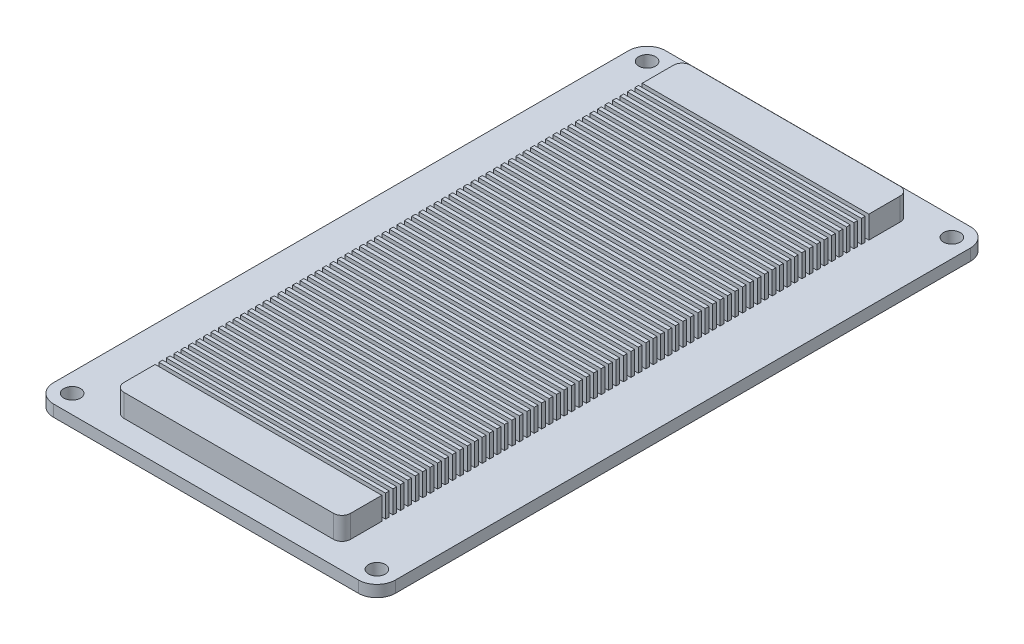
from build123d import *

# Parameters (mm, degrees)
SKETCH1_W                                  = 91.948
SKETCH1_H                                  = 164.6174
BOSS_EXTRUDE1_DEPTH                        = 3.1115
SKETCH5_R                                  = 2.2479
CUT_EXTRUDE2_DEPTH                         = 95.329275434
MIRROR1_AT_THE_SECOND_PLANE_COPY_1_SKETC_R = 2.2479
MIRROR1_AT_THE_SECOND_PLANE_COPY_1_DEPTH   = 95.329275434
SKETCH7_W                                  = 60.96
SKETCH7_H                                  = 0.999999964
BOSS_EXTRUDE2_DEPTH                        = 6.0706
LPATTERN1_COUNT                            = 66
LPATTERN1_PITCH                            = 2.000000064
LPATTERN1_COL_COUNT                        = 2
LPATTERN1_COL_PITCH                        = 2.000000064
BOSS_EXTRUDE3_DEPTH                        = 6.0706


with BuildPart() as part:
    # Sketch1 → Boss-Extrude1 (new body)
    with BuildSketch(Plane(origin=(0, 0, 0), x_dir=(1, 0, 0), z_dir=(0, 1, 0))):
        Rectangle(SKETCH1_W, SKETCH1_H)
    extrude(amount=BOSS_EXTRUDE1_DEPTH)

    # Sketch5 → Cut-Extrude2 (cut, through all)
    with BuildSketch(Plane(origin=(0, 3.1115, 0), x_dir=(1, 0, 0), z_dir=(0, 1, 0))):
        with Locations(Location((40.9829, 77.3176, 0), (0, 0, 270))):
            Circle(SKETCH5_R)
        with BuildLine():
            Line((45.974, 77.3176), (45.974, 82.3087))
            Line((45.974, 82.3087), (40.9829, 82.3087))
            ThreePointArc((40.9829, 82.3087), (44.512140656, 80.846840656), (45.974, 77.3176))
        make_face()
    cut_extrude2 = extrude(amount=-CUT_EXTRUDE2_DEPTH, mode=Mode.SUBTRACT)

    # Mirror1: Cut-Extrude2 across plane
    add(cut_extrude2.mirror(Plane(origin=(0, 0, 0), x_dir=(0, 0, 1), z_dir=(1, 0, 0))), mode=Mode.SUBTRACT)

    # Mirror1 at the second plane: Cut-Extrude2 across plane
    add(cut_extrude2.mirror(Plane.XY), mode=Mode.SUBTRACT)

    # Mirror1 at the second plane copy 1 sketc → Mirror1 at the second plane copy 1 (cut, through all)
    with BuildSketch(Plane(origin=(0, 3.1115, 0), x_dir=(-1, 0, 0), z_dir=(0, 1, 0))):
        with Locations(Location((40.9829, 77.3176, 0), (0, 0, 270))):
            Circle(MIRROR1_AT_THE_SECOND_PLANE_COPY_1_SKETC_R)
        with BuildLine():
            Line((45.974, 77.3176), (45.974, 82.3087))
            Line((45.974, 82.3087), (40.9829, 82.3087))
            ThreePointArc((40.9829, 82.3087), (44.512140656, 80.846840656), (45.974, 77.3176))
        make_face()
    extrude(amount=-MIRROR1_AT_THE_SECOND_PLANE_COPY_1_DEPTH, mode=Mode.SUBTRACT)

    # Sketch7 → Boss-Extrude2 (add)
    with BuildSketch(Plane(origin=(0, 3.1115, 0), x_dir=(1, 0, 0), z_dir=(0, 1, 0))):
        with Locations((0, -64)):
            Rectangle(SKETCH7_W, SKETCH7_H)
    boss_extrude2 = extrude(amount=BOSS_EXTRUDE2_DEPTH)

    # LPattern1: Boss-Extrude2 ×66
    with Locations(*[(0, 0, -i * LPATTERN1_PITCH) for i in range(1, LPATTERN1_COUNT)]):
        add(boss_extrude2)

    # LPattern1 col: Boss-Extrude2 ×2
    with Locations(*[(0, 0, i * LPATTERN1_COL_PITCH) for i in range(1, LPATTERN1_COL_COUNT)]):
        add(boss_extrude2)

    # Sketch8 → Boss-Extrude3 (add)
    with BuildSketch(Plane(origin=(0, 3.1115, 0), x_dir=(1, 0, 0), z_dir=(0, 1, 0))):
        with BuildLine():
            Line((28.194, -76.2), (-28.194, -76.2))
            ThreePointArc((-28.194, -76.2), (-29.810446102, -75.530446102), (-30.48, -73.914))
            Line((-30.48, -73.914), (-30.48, -66.500000046))
            Line((-30.48, -66.500000046), (30.48, -66.500000046))
            Line((30.48, -66.500000046), (30.48, -73.914))
            ThreePointArc((30.48, -73.914), (29.810446102, -75.530446102), (28.194, -76.2))
        make_face()
        with BuildLine():
            Line((30.48, 73.914), (30.48, 66.500004142))
            Line((30.48, 66.500004142), (-30.48, 66.500004142))
            Line((-30.48, 66.500004142), (-30.48, 73.914))
            ThreePointArc((-30.48, 73.914), (-29.810446102, 75.530446102), (-28.194, 76.2))
            Line((-28.194, 76.2), (28.194, 76.2))
            ThreePointArc((28.194, 76.2), (29.810446102, 75.530446102), (30.48, 73.914))
        make_face()
    extrude(amount=BOSS_EXTRUDE3_DEPTH)


solid = part.part
